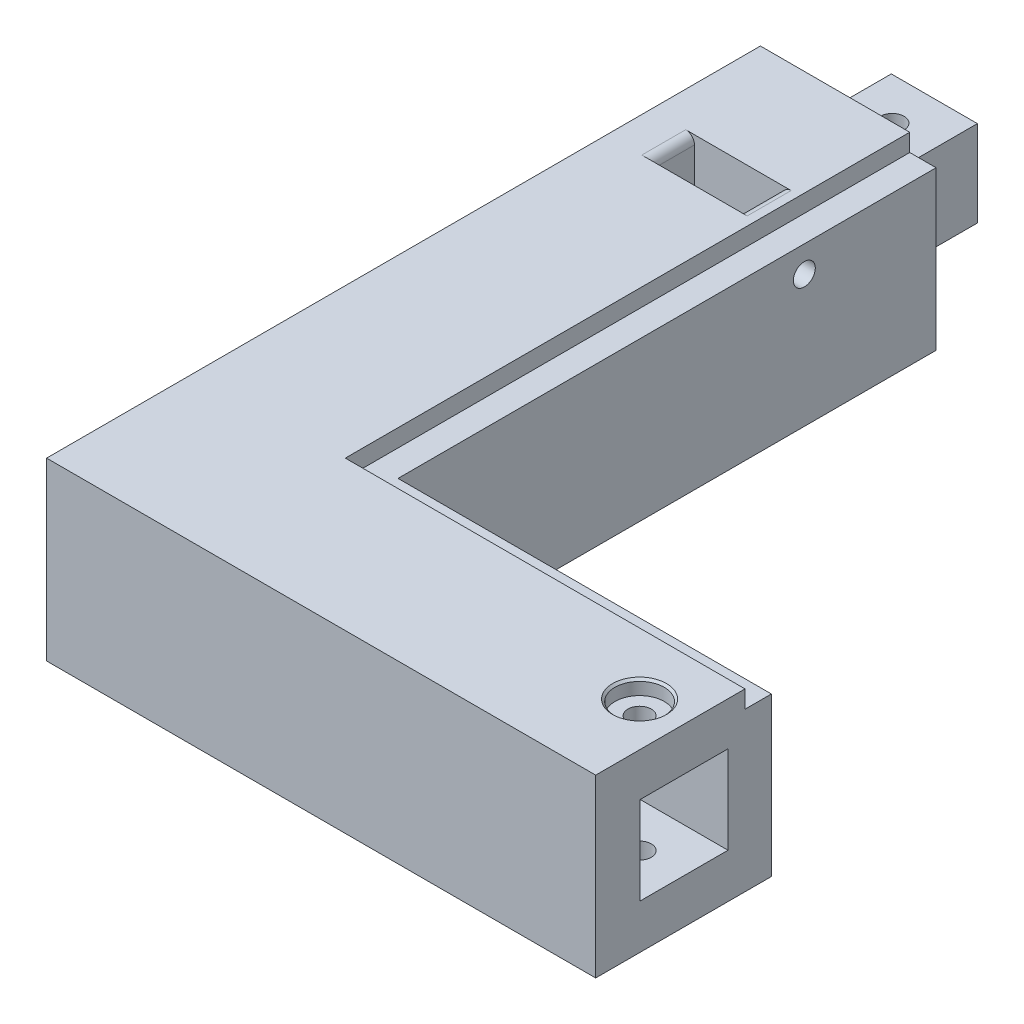
from build123d import *

# Parameters (mm, degrees)
BOSS_EXTRUDE1_DEPTH = 50.8
SKETCH3_W           = 25.4
SKETCH3_H           = 25.4
CUT_EXTRUDE1_DEPTH  = 25.4
SKETCH8_W           = 24.892
SKETCH8_H           = 24.892
BOSS_EXTRUDE2_DEPTH = 24.892
SKETCH12_R          = 3.429
CUT_EXTRUDE2_DEPTH  = 25.4
SKETCH13_W          = 25.4
SKETCH13_H          = 12.7
CUT_EXTRUDE3_DEPTH  = 25.908
FILLET1_R           = 2.54
SKETCH14_R          = 3.175
CUT_EXTRUDE5_DEPTH  = 246.663470197
CUT_EXTRUDE6_DEPTH  = 5.08


with BuildPart() as part:
    # Sketch2 → Boss-Extrude1 (new body)
    with BuildSketch(Plane(origin=(0, 0, 0), x_dir=(1, 0, 0), z_dir=(0, 1, 0))):
        Polygon((-50.8, 155.575), (0, 155.575), (0, 0), (107.95, 0), (107.95, -50.8), (-50.8, -50.8), align=None)
    extrude(amount=BOSS_EXTRUDE1_DEPTH)

    # Sketch3 → Cut-Extrude1 (cut)
    with BuildSketch(Plane(origin=(107.95, 0, 0), x_dir=(0, 0, -1), z_dir=(1, 0, 0))):
        with Locations((-25.239912, 25.560088)):
            Rectangle(SKETCH3_W, SKETCH3_H)
    extrude(amount=-CUT_EXTRUDE1_DEPTH, mode=Mode.SUBTRACT)

    # Sketch7 → CBORE for 1/4 Binding Head Machine Screw1 (revolve, cut)
    with BuildSketch(Plane(origin=(95.25, 50.8, 25.4), x_dir=(0, 0, 1), z_dir=(1, 0, 0))):
        Polygon((0, 0), (0, 50.8), (3.3782, 50.8), (3.3782, 4.191), (7.14375, 4.191), (7.14375, 0.635), (7.77875, 0), align=None)
    revolve(axis=Axis((95.25, 57.15, 25.4), (0, -1, 0)), mode=Mode.SUBTRACT)

    # Sketch8 → Boss-Extrude2 (add)
    with BuildSketch(Plane(origin=(0, 0, -155.575), x_dir=(-1, 0, 0), z_dir=(0, 0, -1))):
        with Locations((25.4, 25.4)):
            Rectangle(SKETCH8_W, SKETCH8_H)
    extrude(amount=BOSS_EXTRUDE2_DEPTH)

    # Sketch12 → Cut-Extrude2 (cut)
    with BuildSketch(Plane(origin=(0, 37.846, 0), x_dir=(1, 0, 0), z_dir=(0, 1, 0))):
        with Locations(Location((-25.4, 168.275, 0), (0, 0, 270))):
            Circle(SKETCH12_R)
    extrude(amount=-CUT_EXTRUDE2_DEPTH, mode=Mode.SUBTRACT)

    # Sketch13 → Cut-Extrude3 (cut)
    with BuildSketch(Plane(origin=(0, 50.8, 0), x_dir=(1, 0, 0), z_dir=(0, 1, 0))):
        with Locations((-25.4, 117.475)):
            Rectangle(SKETCH13_W, SKETCH13_H)
    extrude(amount=-CUT_EXTRUDE3_DEPTH, mode=Mode.SUBTRACT)

    # Fillet1
    fillet1_edges = [part.edges().sort_by_distance(p)[0] for p in [
        (-38.1, 50.8, -117.475),
        (-12.7, 50.8, -117.475),
    ]]
    fillet(fillet1_edges, radius=FILLET1_R)

    # Sketch14 → Cut-Extrude5 (cut, through all)
    with BuildSketch(Plane.ZY.offset(50.8)):
        with Locations((-117.475, 38.1)):
            Circle(SKETCH14_R)
    extrude(amount=-CUT_EXTRUDE5_DEPTH, mode=Mode.SUBTRACT)

    # Sketch17 → Cut-Extrude6 (cut)
    with BuildSketch(Plane(origin=(0, 50.8, 0), x_dir=(1, 0, 0), z_dir=(0, 1, 0))):
        Polygon((0, 155.575), (0, 0), (107.95, 0), (107.95, -7.62), (-7.62, -7.62), (-7.62, 155.575), align=None)
    extrude(amount=-CUT_EXTRUDE6_DEPTH, mode=Mode.SUBTRACT)


solid = part.part
